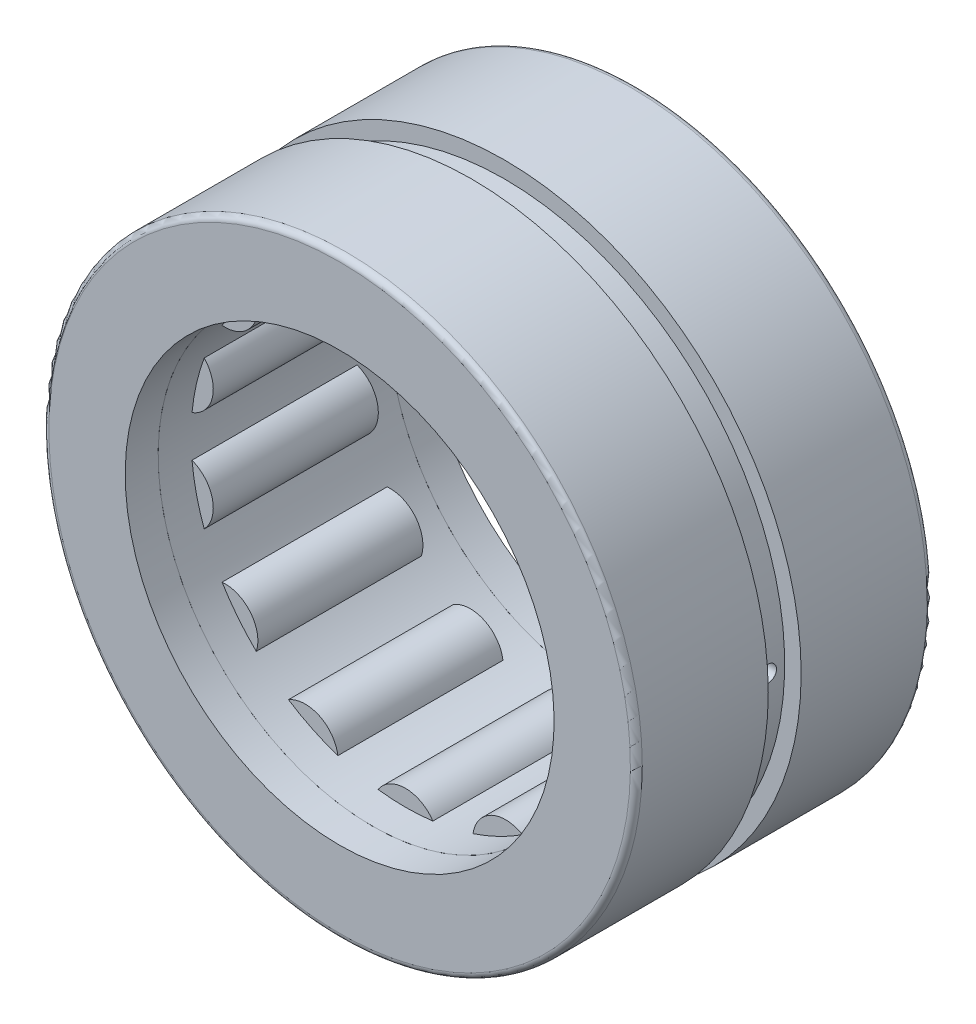
from build123d import *

# Parameters (mm, degrees)
SKETCH2_W           = 10.598573334
SKETCH2_H           = 1.5846425
SKETCH3_W           = 14.824286666
SKETCH3_H           = 0.528214166
CIRPATTERN1_COUNT   = 14
CIRPATTERN1_ANGLE   = 334.285714286
FILLET1_R           = 0.381
SKETCH5_R           = 17.191143333
SKETCH5_R_2         = 13.767858333
BOSS_EXTRUDE1_DEPTH = 14.824286667
SKETCH2_3_W         = 10.598573334
SKETCH2_3_H         = 1.5846425
CIRPATTERN2_COUNT   = 14
SKETCH6_W           = 2.112856666
SKETCH6_H           = 1.056428333
SKETCH7_R           = 0.528214167
CUT_EXTRUDE1_DEPTH  = 29.575000067


with BuildPart() as part:
    # Sketch1 → Revolve1 (revolve)
    with BuildSketch(Plane(origin=(0, 0, 0), x_dir=(0, 0, -1), z_dir=(1, 0, 0)), mode=Mode.PRIVATE) as revolve1_sk:
        Polygon((-9.525, 19.05), (9.525, 19.05), (9.525, 13.767858333), (7.412143333, 13.767858333), (7.412143333, 16.937143333), (-7.412143333, 16.937143333), (-7.412143333, 13.767858333), (-9.525, 13.767858333), align=None)
    revolve(revolve1_sk.sketch.rotate(Axis((0, 0, 9.525), (0, 0, -1)), 180), axis=Axis((0, 0, 9.525), (0, 0, -1)))

    # Fillet1
    fillet1_edges = [part.edges().sort_by_distance(p)[0] for p in [
        (0, 19.05, 9.525),
        (0, 19.05, -9.525),
    ]]
    fillet(fillet1_edges, radius=FILLET1_R)

    # Sketch4 → Cut-Revolve1 (revolve, cut)
    with BuildSketch(Plane(origin=(0, 0, 0), x_dir=(0, 0, -1), z_dir=(1, 0, 0)), mode=Mode.PRIVATE) as cut_revolve1_sk:
        Polygon((-1.056428333, 19.05), (0, 17.993571667), (1.056428333, 19.05), align=None)
    revolve(cut_revolve1_sk.sketch.rotate(Axis((0, 0, 9.525), (0, 0, -1)), 180), axis=Axis((0, 0, 9.525), (0, 0, -1)), mode=Mode.SUBTRACT)

    # Sketch6 → Cut-Revolve4 (revolve, cut)
    with BuildSketch(Plane(origin=(0, 0, 0), x_dir=(0, 0, -1), z_dir=(1, 0, 0))):
        with Locations((0, 18.521785834)):
            Rectangle(SKETCH6_W, SKETCH6_H)
    revolve(axis=Axis((0, 0, 9.525), (0, 0, 1)), mode=Mode.SUBTRACT)

    # Sketch7 → Cut-Extrude1 (cut, through all)
    with BuildSketch(Plane(origin=(0, 0, 0), x_dir=(0, 0, -1), z_dir=(1, 0, 0))):
        with Locations(Location((0, 0, 0), (0, 0, 180))):
            Circle(SKETCH7_R)
    extrude(amount=CUT_EXTRUDE1_DEPTH, mode=Mode.SUBTRACT)


with BuildPart() as body_2:
    # Sketch2 → Revolve2 (revolve)
    with BuildSketch(Plane(origin=(0, 0, 0), x_dir=(0, 0, -1), z_dir=(1, 0, 0)), mode=Mode.PRIVATE) as revolve2_sk:
        with Locations((0, 16.144822083)):
            Rectangle(SKETCH2_W, SKETCH2_H)
    revolve(revolve2_sk.sketch.rotate(Axis((0, 14.824286667, 5.299286667), (0, 0, -1)), 180), axis=Axis((0, 14.824286667, 5.299286667), (0, 0, -1)))


with BuildPart() as body_3:
    # Sketch3 → Revolve3 (revolve)
    with BuildSketch(Plane(origin=(0, 0, 0), x_dir=(0, 0, -1), z_dir=(1, 0, 0)), mode=Mode.PRIVATE) as revolve3_sk:
        with Locations((0, 15.08839375)):
            Rectangle(SKETCH3_W, SKETCH3_H)
    revolve(revolve3_sk.sketch.rotate(Axis((0, 14.824286667, 7.412143333), (0, 0, -1)), 90), axis=Axis((0, 14.824286667, 7.412143333), (0, 0, -1)))


with BuildPart() as cirpattern1_1:
    # CirPattern1: pattern copy
    add(body_3.part.rotate(Axis((0, 0, -9.525), (0, 0, 1)), 1 * CIRPATTERN1_ANGLE / (CIRPATTERN1_COUNT - 1)))


with BuildPart() as cirpattern1_2:
    # CirPattern1: pattern copy
    add(body_3.part.rotate(Axis((0, 0, -9.525), (0, 0, 1)), 2 * CIRPATTERN1_ANGLE / (CIRPATTERN1_COUNT - 1)))


with BuildPart() as cirpattern1_3:
    # CirPattern1: pattern copy
    add(body_3.part.rotate(Axis((0, 0, -9.525), (0, 0, 1)), 3 * CIRPATTERN1_ANGLE / (CIRPATTERN1_COUNT - 1)))


with BuildPart() as cirpattern1_4:
    # CirPattern1: pattern copy
    add(body_3.part.rotate(Axis((0, 0, -9.525), (0, 0, 1)), 4 * CIRPATTERN1_ANGLE / (CIRPATTERN1_COUNT - 1)))


with BuildPart() as cirpattern1_5:
    # CirPattern1: pattern copy
    add(body_3.part.rotate(Axis((0, 0, -9.525), (0, 0, 1)), 5 * CIRPATTERN1_ANGLE / (CIRPATTERN1_COUNT - 1)))


with BuildPart() as cirpattern1_6:
    # CirPattern1: pattern copy
    add(body_3.part.rotate(Axis((0, 0, -9.525), (0, 0, 1)), 6 * CIRPATTERN1_ANGLE / (CIRPATTERN1_COUNT - 1)))


with BuildPart() as cirpattern1_7:
    # CirPattern1: pattern copy
    add(body_3.part.rotate(Axis((0, 0, -9.525), (0, 0, 1)), 7 * CIRPATTERN1_ANGLE / (CIRPATTERN1_COUNT - 1)))


with BuildPart() as cirpattern1_8:
    # CirPattern1: pattern copy
    add(body_3.part.rotate(Axis((0, 0, -9.525), (0, 0, 1)), 8 * CIRPATTERN1_ANGLE / (CIRPATTERN1_COUNT - 1)))


with BuildPart() as cirpattern1_9:
    # CirPattern1: pattern copy
    add(body_3.part.rotate(Axis((0, 0, -9.525), (0, 0, 1)), 9 * CIRPATTERN1_ANGLE / (CIRPATTERN1_COUNT - 1)))


with BuildPart() as cirpattern1_10:
    # CirPattern1: pattern copy
    add(body_3.part.rotate(Axis((0, 0, -9.525), (0, 0, 1)), 10 * CIRPATTERN1_ANGLE / (CIRPATTERN1_COUNT - 1)))


with BuildPart() as cirpattern1_11:
    # CirPattern1: pattern copy
    add(body_3.part.rotate(Axis((0, 0, -9.525), (0, 0, 1)), 11 * CIRPATTERN1_ANGLE / (CIRPATTERN1_COUNT - 1)))


with BuildPart() as cirpattern1_12:
    # CirPattern1: pattern copy
    add(body_3.part.rotate(Axis((0, 0, -9.525), (0, 0, 1)), 12 * CIRPATTERN1_ANGLE / (CIRPATTERN1_COUNT - 1)))


with BuildPart() as cirpattern1_13:
    # CirPattern1: pattern copy
    add(body_3.part.rotate(Axis((0, 0, -9.525), (0, 0, 1)), 13 * CIRPATTERN1_ANGLE / (CIRPATTERN1_COUNT - 1)))


with BuildPart() as cirpattern1_14:
    # CirPattern1: pattern copy
    add(body_2.part.rotate(Axis((0, 0, -9.525), (0, 0, 1)), 1 * CIRPATTERN1_ANGLE / (CIRPATTERN1_COUNT - 1)))


with BuildPart() as cirpattern1_15:
    # CirPattern1: pattern copy
    add(body_2.part.rotate(Axis((0, 0, -9.525), (0, 0, 1)), 2 * CIRPATTERN1_ANGLE / (CIRPATTERN1_COUNT - 1)))


with BuildPart() as cirpattern1_16:
    # CirPattern1: pattern copy
    add(body_2.part.rotate(Axis((0, 0, -9.525), (0, 0, 1)), 3 * CIRPATTERN1_ANGLE / (CIRPATTERN1_COUNT - 1)))


with BuildPart() as cirpattern1_17:
    # CirPattern1: pattern copy
    add(body_2.part.rotate(Axis((0, 0, -9.525), (0, 0, 1)), 4 * CIRPATTERN1_ANGLE / (CIRPATTERN1_COUNT - 1)))


with BuildPart() as cirpattern1_18:
    # CirPattern1: pattern copy
    add(body_2.part.rotate(Axis((0, 0, -9.525), (0, 0, 1)), 5 * CIRPATTERN1_ANGLE / (CIRPATTERN1_COUNT - 1)))


with BuildPart() as cirpattern1_19:
    # CirPattern1: pattern copy
    add(body_2.part.rotate(Axis((0, 0, -9.525), (0, 0, 1)), 6 * CIRPATTERN1_ANGLE / (CIRPATTERN1_COUNT - 1)))


with BuildPart() as cirpattern1_20:
    # CirPattern1: pattern copy
    add(body_2.part.rotate(Axis((0, 0, -9.525), (0, 0, 1)), 7 * CIRPATTERN1_ANGLE / (CIRPATTERN1_COUNT - 1)))


with BuildPart() as cirpattern1_21:
    # CirPattern1: pattern copy
    add(body_2.part.rotate(Axis((0, 0, -9.525), (0, 0, 1)), 8 * CIRPATTERN1_ANGLE / (CIRPATTERN1_COUNT - 1)))


with BuildPart() as cirpattern1_22:
    # CirPattern1: pattern copy
    add(body_2.part.rotate(Axis((0, 0, -9.525), (0, 0, 1)), 9 * CIRPATTERN1_ANGLE / (CIRPATTERN1_COUNT - 1)))


with BuildPart() as cirpattern1_23:
    # CirPattern1: pattern copy
    add(body_2.part.rotate(Axis((0, 0, -9.525), (0, 0, 1)), 10 * CIRPATTERN1_ANGLE / (CIRPATTERN1_COUNT - 1)))


with BuildPart() as cirpattern1_24:
    # CirPattern1: pattern copy
    add(body_2.part.rotate(Axis((0, 0, -9.525), (0, 0, 1)), 11 * CIRPATTERN1_ANGLE / (CIRPATTERN1_COUNT - 1)))


with BuildPart() as cirpattern1_25:
    # CirPattern1: pattern copy
    add(body_2.part.rotate(Axis((0, 0, -9.525), (0, 0, 1)), 12 * CIRPATTERN1_ANGLE / (CIRPATTERN1_COUNT - 1)))


with BuildPart() as cirpattern1_26:
    # CirPattern1: pattern copy
    add(body_2.part.rotate(Axis((0, 0, -9.525), (0, 0, 1)), 13 * CIRPATTERN1_ANGLE / (CIRPATTERN1_COUNT - 1)))


with BuildPart() as body_30:
    # Sketch5 → Boss-Extrude1 (new body)
    with BuildSketch(Plane(origin=(0, 0, 7.412143333), x_dir=(-1, 0, 0), z_dir=(0, 0, -1))):
        with Locations(Location((0, 0, 0), (0, 0, 90))):
            Circle(SKETCH5_R)
        with Locations(Location((0, 0, 0), (0, 0, 90))):
            Circle(SKETCH5_R_2, mode=Mode.SUBTRACT)
    extrude(amount=BOSS_EXTRUDE1_DEPTH)

    # Sketch2<3> → Cut-Revolve3 (revolve, cut)
    with BuildSketch(Plane(origin=(0, 0, 0), x_dir=(0, 0, -1), z_dir=(1, 0, 0))):
        with Locations((0, 16.144822083)):
            Rectangle(SKETCH2_3_W, SKETCH2_3_H)
    cut_revolve3 = revolve(axis=Axis((0, 14.824286667, 5.299286667), (0, 0, -1)), mode=Mode.SUBTRACT)

    # CirPattern2: Cut-Revolve3 ×14 about axis
    cirpattern2_axis = Axis((0, 0, 0), (0, 0, 1))
    for i in range(1, CIRPATTERN2_COUNT):
        add(cut_revolve3.rotate(cirpattern2_axis, i * 360 / CIRPATTERN2_COUNT), mode=Mode.SUBTRACT)


solid = Compound([part.part, body_2.part, body_3.part, cirpattern1_1.part, cirpattern1_2.part, cirpattern1_3.part, cirpattern1_4.part, cirpattern1_5.part, cirpattern1_6.part, cirpattern1_7.part, cirpattern1_8.part, cirpattern1_9.part, cirpattern1_10.part, cirpattern1_11.part, cirpattern1_12.part, cirpattern1_13.part, cirpattern1_14.part, cirpattern1_15.part, cirpattern1_16.part, cirpattern1_17.part, cirpattern1_18.part, cirpattern1_19.part, cirpattern1_20.part, cirpattern1_21.part, cirpattern1_22.part, cirpattern1_23.part, cirpattern1_24.part, cirpattern1_25.part, cirpattern1_26.part, body_30.part])
